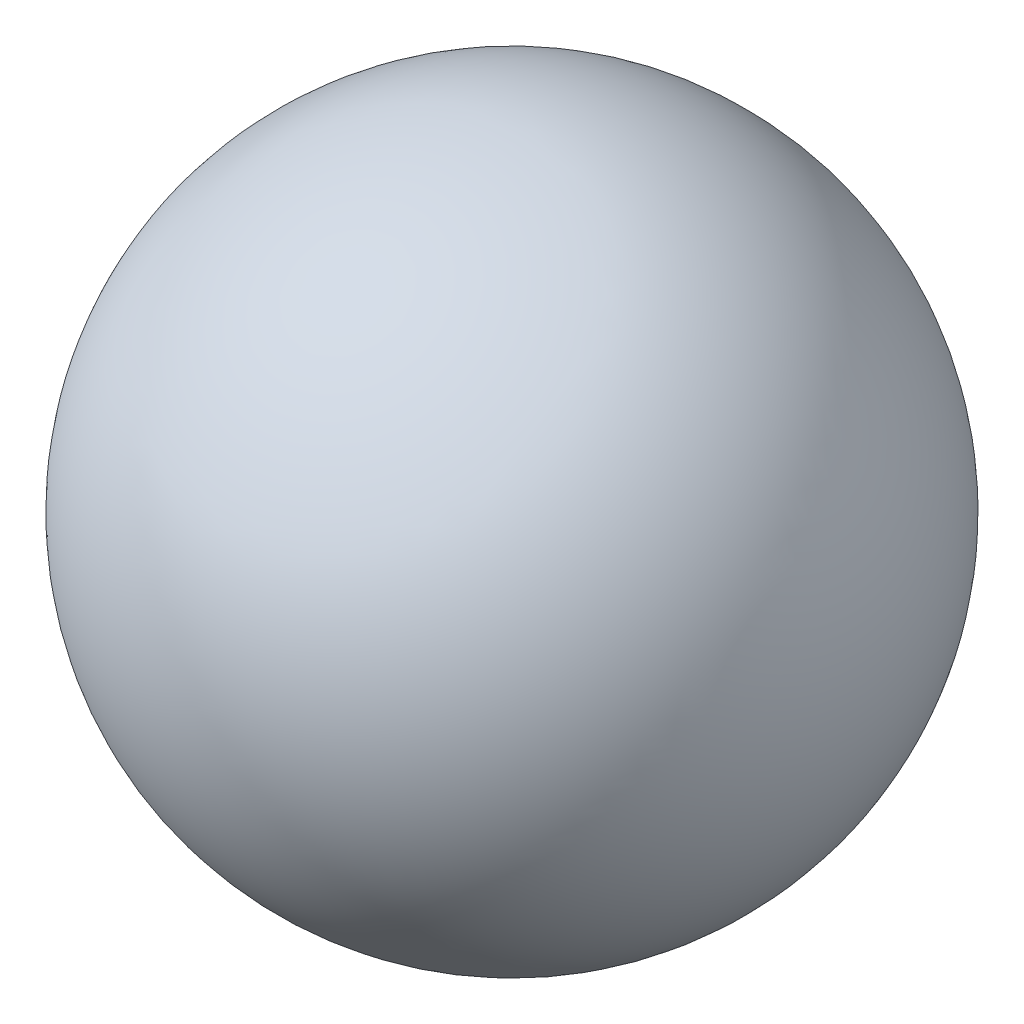
from build123d import *


with BuildPart() as part:
    # Эскиз1 → Повернуть1 (revolve)
    with BuildSketch(Plane.XY):
        with BuildLine():
            Line((-5, 0), (5, 0))
            ThreePointArc((5, 0), (0, 5), (-5, 0))
        make_face()
    revolve(axis=Axis((-5, 0, 0), (1, 0, 0)))


with BuildPart() as body_2:
    # Эскиз2 → Повернуть2 (revolve)
    with BuildSketch(Plane.XY):
        with BuildLine():
            Line((-10, 0), (10, 0))
            ThreePointArc((10, 0), (0, 10), (-10, 0))
        make_face()
    revolve(axis=Axis((-10, 0, 0), (1, 0, 0)))


solid = Compound([part.part, body_2.part])
